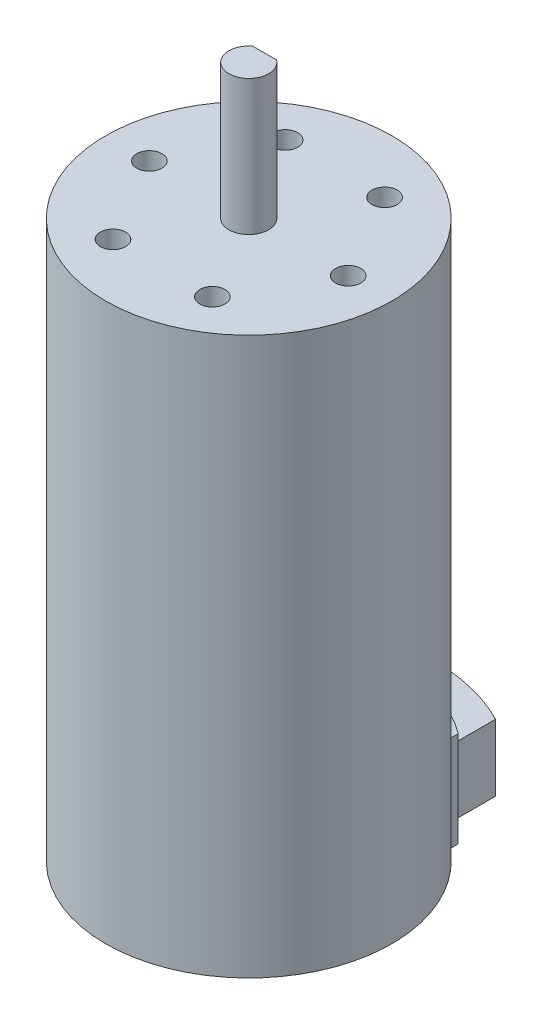
from build123d import *

# Parameters (mm, degrees)
SKETCH1_R               = 18
BOSS_EXTRUDE1_DEPTH     = 70
SKETCH2_R               = 2.5
BOSS_EXTRUDE2_DEPTH     = 17
CUT_EXTRUDE1_START      = -15
CUT_EXTRUDE1_DEPTH      = 15
SKETCH4_R               = 1.5875
CUT_EXTRUDE2_DEPTH      = 12.7
CIRPATTERN1_COUNT       = 6
BOSS_EXTRUDE3_START     = -2.032
BOSS_EXTRUDE3_DEPTH     = 8.382
BOSS_EXTRUDE4_DEPTH     = 12.0015
CUT_EXTRUDE3_REACH      = 99.88
CUT_EXTRUDE3_END_RADIUS = 18.8128
SKETCH7_R               = 2.159


with BuildPart() as part:
    # Sketch1 → Boss-Extrude1 (new body)
    with BuildSketch(Plane(origin=(0, 0, 0), x_dir=(1, 0, 0), z_dir=(0, 1, 0))):
        with Locations(Location((0, 0, 0), (0, 0, 270))):
            Circle(SKETCH1_R)
    extrude(amount=BOSS_EXTRUDE1_DEPTH)

    # Sketch2 → Boss-Extrude2 (add)
    with BuildSketch(Plane(origin=(0, 70, 0), x_dir=(1, 0, 0), z_dir=(0, 1, 0))):
        with Locations(Location((0, 0, 0), (0, 0, 270))):
            Circle(SKETCH2_R)
    extrude(amount=BOSS_EXTRUDE2_DEPTH)

    # Sketch3 → Cut-Extrude1 (cut)
    with BuildSketch(Plane(origin=(0, 87, 0), x_dir=(1, 0, 0), z_dir=(0, 1, 0)).offset(CUT_EXTRUDE1_START)):
        with BuildLine():
            Line((-1.5, 2), (1.5, 2))
            ThreePointArc((1.5, 2), (0, 2.5), (-1.5, 2))
        make_face()
    extrude(amount=CUT_EXTRUDE1_DEPTH, mode=Mode.SUBTRACT)

    # Sketch4 → Cut-Extrude2 (cut)
    with BuildSketch(Plane(origin=(0, 70, 0), x_dir=(1, 0, 0), z_dir=(0, 1, 0))):
        with Locations(Location((-6.25, 10.825317547, 0), (0, 0, 270))):
            Circle(SKETCH4_R)
    cut_extrude2 = extrude(amount=-CUT_EXTRUDE2_DEPTH, mode=Mode.SUBTRACT)

    # CirPattern1: Cut-Extrude2 ×6 about axis
    cirpattern1_axis = Axis((0, 0, 0), (0, 1, 0))
    for i in range(1, CIRPATTERN1_COUNT):
        add(cut_extrude2.rotate(cirpattern1_axis, i * 360 / CIRPATTERN1_COUNT), mode=Mode.SUBTRACT)

    # Sketch5 → Boss-Extrude3 (add)
    with BuildSketch(Plane.XZ.offset(BOSS_EXTRUDE3_START)):
        with BuildLine():
            Line((10.4775, -20.564736656), (10.4775, -14.636324462))
            ThreePointArc((10.4775, -14.636324462), (0, -18), (-10.4775, -14.636324462))
            Line((-10.4775, -14.636324462), (-10.4775, -20.564736656))
            ThreePointArc((-10.4775, -20.564736656), (0, -23.08), (10.4775, -20.564736656))
        make_face()
    extrude(amount=-BOSS_EXTRUDE3_DEPTH)

    # Sketch6 → Boss-Extrude4 (add)
    with BuildSketch(Plane.XZ):
        with BuildLine():
            Line((-11.2903, -14.018884617), (-11.2903, -15.048274644))
            ThreePointArc((-11.2903, -15.048274644), (0, -18.8128), (11.2903, -15.048274644))
            Line((11.2903, -15.048274644), (11.2903, -14.018884617))
            ThreePointArc((11.2903, -14.018884617), (0, -18), (-11.2903, -14.018884617))
        make_face()
    extrude(amount=-BOSS_EXTRUDE4_DEPTH)

    # Cut-Extrude3: up to this cylinder (the profile starts outside it)
    cut_extrude3_end = Plane(origin=(0, 6.223, 0), z_dir=(0, -1, 0)) * Cylinder(CUT_EXTRUDE3_END_RADIUS, 238.3856, mode=Mode.PRIVATE)
    # Sketch7 → Cut-Extrude3 (cut, up to the surface)
    with BuildSketch(Plane(origin=(0, 0, -23.08), x_dir=(-1, 0, 0), z_dir=(0, 0, -1)), mode=Mode.PRIVATE) as cut_extrude3_sk1:
        with Locations((-6.858, 6.223)):
            Circle(SKETCH7_R)
    cut_extrude3_tool1 = extrude(cut_extrude3_sk1.sketch, amount=-CUT_EXTRUDE3_REACH, mode=Mode.PRIVATE) - cut_extrude3_end
    add(cut_extrude3_tool1.solids().sort_by_distance((6.858, 6.223, -23.08))[0], mode=Mode.SUBTRACT)
    # Sketch7 → Cut-Extrude3 (cut, up to the surface)
    with BuildSketch(Plane(origin=(0, 0, -23.08), x_dir=(-1, 0, 0), z_dir=(0, 0, -1)), mode=Mode.PRIVATE) as cut_extrude3_sk2:
        with Locations((0, 6.223)):
            Circle(SKETCH7_R)
    cut_extrude3_tool2 = extrude(cut_extrude3_sk2.sketch, amount=-CUT_EXTRUDE3_REACH, mode=Mode.PRIVATE) - cut_extrude3_end
    add(cut_extrude3_tool2.solids().sort_by_distance((0, 6.223, -23.08))[0], mode=Mode.SUBTRACT)
    # Sketch7 → Cut-Extrude3 (cut, up to the surface)
    with BuildSketch(Plane(origin=(0, 0, -23.08), x_dir=(-1, 0, 0), z_dir=(0, 0, -1)), mode=Mode.PRIVATE) as cut_extrude3_sk3:
        with Locations((6.858, 6.223)):
            Circle(SKETCH7_R)
    cut_extrude3_tool3 = extrude(cut_extrude3_sk3.sketch, amount=-CUT_EXTRUDE3_REACH, mode=Mode.PRIVATE) - cut_extrude3_end
    add(cut_extrude3_tool3.solids().sort_by_distance((-6.858, 6.223, -23.08))[0], mode=Mode.SUBTRACT)


solid = part.part
